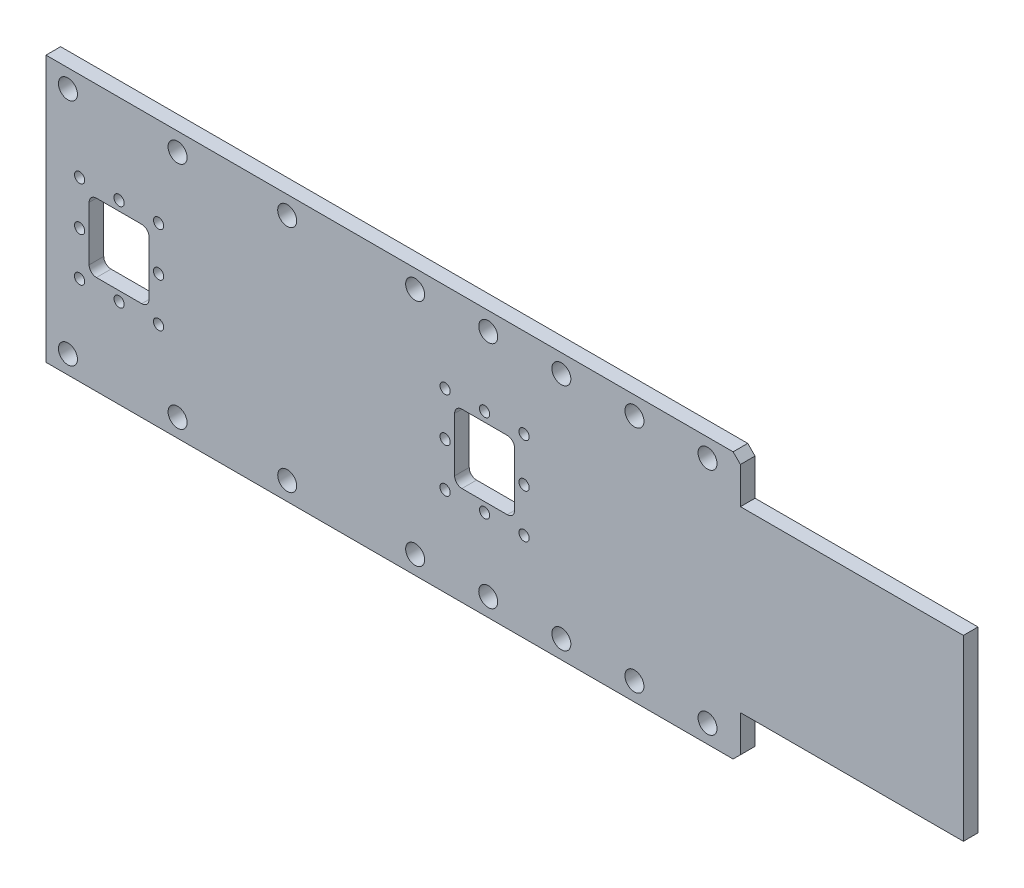
from build123d import *

# Parameters (mm, degrees)
SKETCH_1_W          = 1255
SKETCH_1_H          = 364
EXTRUDE_1_DEPTH     = 20
SKETCH_2_W          = 305
SKETCH_2_H          = 60
CUT_EXTRUDE_1_DEPTH = 654.666772905
CHAMFER_1_SIZE      = 10
SKETCH_3_R          = 13
SKETCH_3_R_2        = 7
CUT_EXTRUDE_2_DEPTH = 20


with BuildPart() as part:
    # 草图1 → 凸台-拉伸1 (new body)
    with BuildSketch(Plane.XY):
        Rectangle(SKETCH_1_W, SKETCH_1_H)
    extrude(amount=-EXTRUDE_1_DEPTH)

    # 草图2 → 切除-拉伸1 (cut, through all)
    with BuildSketch(Plane.XY):
        with Locations((475, 152)):
            Rectangle(SKETCH_2_W, SKETCH_2_H)
        with Locations((475, -152)):
            Rectangle(SKETCH_2_W, SKETCH_2_H)
    extrude(amount=-CUT_EXTRUDE_1_DEPTH, mode=Mode.SUBTRACT)

    # 倒角1
    chamfer_1_edges = [part.edges().sort_by_distance(p)[0] for p in [
        (322.5, 182, -10),
        (322.5, -182, -10),
    ]]
    chamfer(chamfer_1_edges, length=CHAMFER_1_SIZE)

    # 草图3 → 切除-拉伸2 (cut)
    with BuildSketch(Plane.XY):
        with Locations((-597.5, 157)):
            Circle(SKETCH_3_R)
        with Locations((-447.5, 157)):
            Circle(SKETCH_3_R)
        with Locations((-297.5, 157)):
            Circle(SKETCH_3_R)
        with Locations((-122.5, 157)):
            Circle(SKETCH_3_R)
        with Locations((-22.5, 157)):
            Circle(SKETCH_3_R)
        with Locations((77.5, 157)):
            Circle(SKETCH_3_R)
        with Locations((177.5, 157)):
            Circle(SKETCH_3_R)
        with Locations((277.5, 157)):
            Circle(SKETCH_3_R)
        with Locations((277.5, -157)):
            Circle(SKETCH_3_R)
        with Locations((177.5, -157)):
            Circle(SKETCH_3_R)
        with Locations((77.5, -157)):
            Circle(SKETCH_3_R)
        with Locations((-22.5, -157)):
            Circle(SKETCH_3_R)
        with Locations((-122.5, -157)):
            Circle(SKETCH_3_R)
        with Locations((-297.5, -157)):
            Circle(SKETCH_3_R)
        with Locations((-447.5, -157)):
            Circle(SKETCH_3_R)
        with Locations((-597.5, -157)):
            Circle(SKETCH_3_R)
        with Locations((-581.5, 60)):
            Circle(SKETCH_3_R_2)
        with Locations((-527.5, 60)):
            Circle(SKETCH_3_R_2)
        with Locations((-473.5, 60)):
            Circle(SKETCH_3_R_2)
        with Locations((-473.5, 0)):
            Circle(SKETCH_3_R_2)
        with Locations((-581.5, 0)):
            Circle(SKETCH_3_R_2)
        with Locations((-581.5, -60)):
            Circle(SKETCH_3_R_2)
        with Locations((-527.5, -60)):
            Circle(SKETCH_3_R_2)
        with Locations((-473.5, -60)):
            Circle(SKETCH_3_R_2)
        with Locations((-81.5, 60)):
            Circle(SKETCH_3_R_2)
        with Locations((-27.5, 60)):
            Circle(SKETCH_3_R_2)
        with Locations((26.5, 60)):
            Circle(SKETCH_3_R_2)
        with Locations((26.5, 0)):
            Circle(SKETCH_3_R_2)
        with Locations((-81.5, 0)):
            Circle(SKETCH_3_R_2)
        with Locations((-81.5, -60)):
            Circle(SKETCH_3_R_2)
        with Locations((-27.5, -60)):
            Circle(SKETCH_3_R_2)
        with Locations((26.5, -60)):
            Circle(SKETCH_3_R_2)
        with BuildLine():
            Line((-58.5, 47), (3.5, 47))
            ThreePointArc((3.5, 47), (10.571067812, 44.071067812), (13.5, 37))
            Line((13.5, 37), (13.5, -37))
            ThreePointArc((13.5, -37), (10.571067812, -44.071067812), (3.5, -47))
            Line((3.5, -47), (-58.5, -47))
            ThreePointArc((-58.5, -47), (-65.571067812, -44.071067812), (-68.5, -37))
            Line((-68.5, -37), (-68.5, 37))
            ThreePointArc((-68.5, 37), (-65.571067812, 44.071067812), (-58.5, 47))
        make_face()
        with BuildLine():
            Line((-558.5, 47), (-496.5, 47))
            ThreePointArc((-496.5, 47), (-489.428932188, 44.071067812), (-486.5, 37))
            Line((-486.5, 37), (-486.5, -37))
            ThreePointArc((-486.5, -37), (-489.428932188, -44.071067812), (-496.5, -47))
            Line((-496.5, -47), (-558.5, -47))
            ThreePointArc((-558.5, -47), (-565.571067812, -44.071067812), (-568.5, -37))
            Line((-568.5, -37), (-568.5, 37))
            ThreePointArc((-568.5, 37), (-565.571067812, 44.071067812), (-558.5, 47))
        make_face()
    extrude(amount=-CUT_EXTRUDE_2_DEPTH, mode=Mode.SUBTRACT)


solid = part.part
